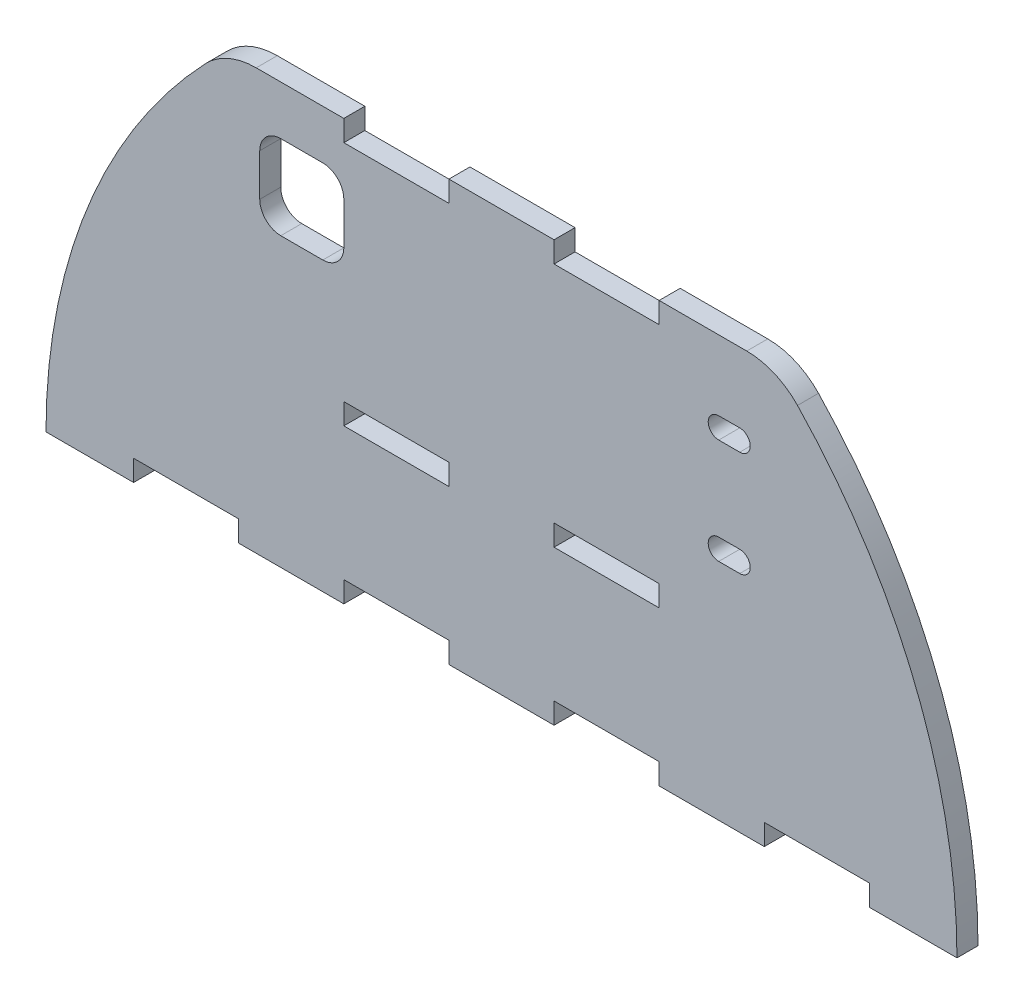
from build123d import *

# Parameters (mm, degrees)
BOSS_EXTRUDE1_DEPTH = 3
SKETCH2_W           = 15
SKETCH2_H           = 3
CUT_EXTRUDE1_DEPTH  = 89.509886453
CUT_EXTRUDE2_DEPTH  = 89.509886453
CUT_EXTRUDE3_DEPTH  = 89.509886453


with BuildPart() as part:
    # Sketch1 → Boss-Extrude1 (new body)
    with BuildSketch(Plane.XY):
        with BuildLine():
            Line((35, 60), (-35, 60))
            ThreePointArc((-35, 60), (-38.939192986, 59.1914503), (-42.24137931, 56.896551724))
            ThreePointArc((-42.24137931, 56.896551724), (-59.099326998, 30.639730799), (-65, 0))
            Line((-65, 0), (65, 0))
            ThreePointArc((65, 0), (59.099326998, 30.639730799), (42.24137931, 56.896551724))
            ThreePointArc((42.24137931, 56.896551724), (38.939192986, 59.1914503), (35, 60))
        make_face()
    extrude(amount=BOSS_EXTRUDE1_DEPTH)

    # Sketch2 → Cut-Extrude1 (cut, through all)
    with BuildSketch(Plane.XY.offset(3)):
        with Locations((-15, 58.5)):
            Rectangle(SKETCH2_W, SKETCH2_H)
        with Locations((-45, 1.5)):
            Rectangle(SKETCH2_W, SKETCH2_H)
        with Locations((-15, 1.5)):
            Rectangle(SKETCH2_W, SKETCH2_H)
        with Locations((-15, 23.5)):
            Rectangle(SKETCH2_W, SKETCH2_H)
    cut_extrude1 = extrude(amount=-CUT_EXTRUDE1_DEPTH, mode=Mode.SUBTRACT)

    # Mirror1: Cut-Extrude1 across plane
    add(cut_extrude1.mirror(Plane(origin=(0, 0, 0), x_dir=(0, 0, 1), z_dir=(1, 0, 0))), mode=Mode.SUBTRACT)

    # Sketch3 → Cut-Extrude2 (cut, through all)
    with BuildSketch(Plane.XY.offset(3)):
        with BuildLine():
            Line((-31.5, 53), (-25.5, 53))
            ThreePointArc((-25.5, 53), (-23.378679656, 52.121320344), (-22.5, 50))
            Line((-22.5, 50), (-22.5, 44))
            ThreePointArc((-22.5, 44), (-23.378679656, 41.878679656), (-25.5, 41))
            Line((-25.5, 41), (-31.5, 41))
            ThreePointArc((-31.5, 41), (-33.621320344, 41.878679656), (-34.5, 44))
            Line((-34.5, 44), (-34.5, 50))
            ThreePointArc((-34.5, 50), (-33.621320344, 52.121320344), (-31.5, 53))
        make_face()
    extrude(amount=-CUT_EXTRUDE2_DEPTH, mode=Mode.SUBTRACT)

    # Sketch4 → Cut-Extrude3 (cut, through all)
    with BuildSketch(Plane.XY.offset(3)):
        with BuildLine():
            Line((31, 50), (34, 50))
            ThreePointArc((34, 50), (35.5, 48.5), (34, 47))
            Line((34, 47), (31, 47))
            ThreePointArc((31, 47), (29.5, 48.5), (31, 50))
        make_face()
        with BuildLine():
            Line((31, 35), (34, 35))
            ThreePointArc((34, 35), (35.5, 33.5), (34, 32))
            Line((34, 32), (31, 32))
            ThreePointArc((31, 32), (29.5, 33.5), (31, 35))
        make_face()
    extrude(amount=-CUT_EXTRUDE3_DEPTH, mode=Mode.SUBTRACT)


solid = part.part
